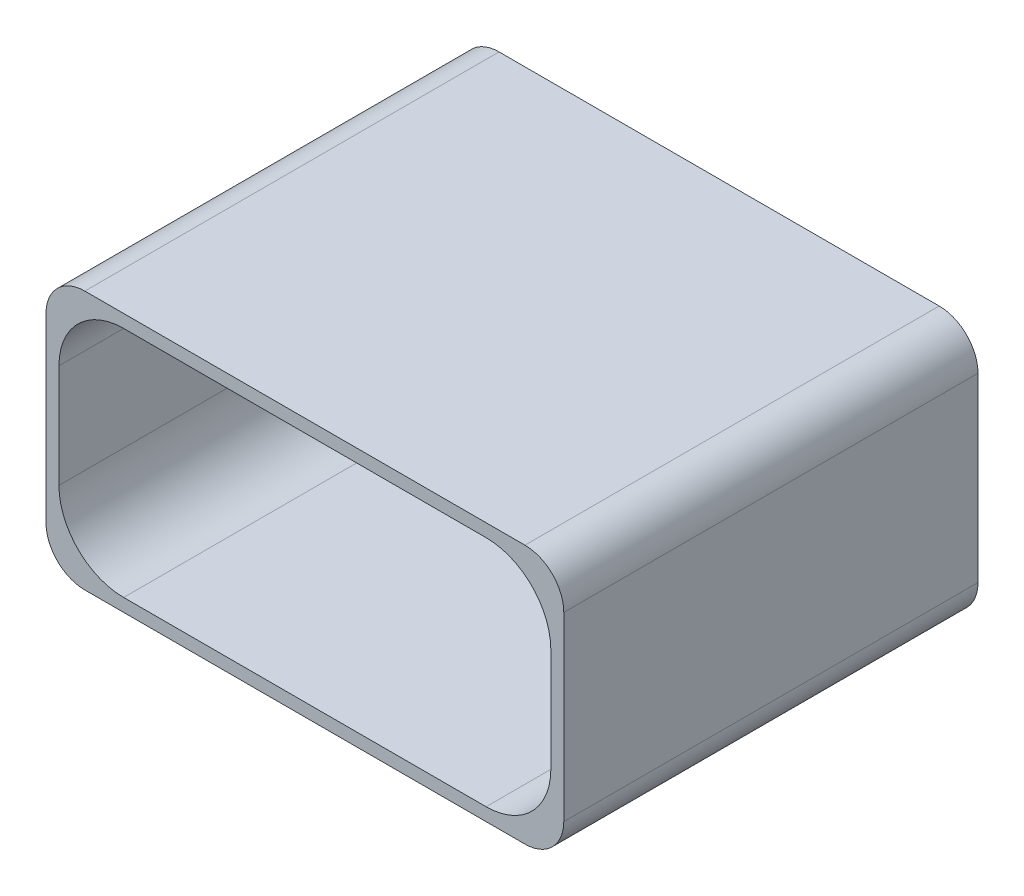
from build123d import *

# Parameters (mm, degrees)
SKETCH1_W           = 200
SKETCH1_H           = 100
BOSS_EXTRUDE1_DEPTH = 10
CUT_EXTRUDE1_DEPTH  = 10
BOSS_EXTRUDE2_START = 150
BOSS_EXTRUDE2_DEPTH = 150
BOSS_EXTRUDE3_DEPTH = 80


with BuildPart() as part:
    # Sketch1 → Boss-Extrude1 (new body)
    with BuildSketch(Plane.XY):
        with Locations((100, 50)):
            Rectangle(SKETCH1_W, SKETCH1_H)
    extrude(amount=BOSS_EXTRUDE1_DEPTH)

    # Sketch2 → Cut-Extrude1 (cut)
    with BuildSketch(Plane.XY.offset(10)):
        with BuildLine():
            ThreePointArc((0, 85), (4.393398282, 95.606601718), (15, 100))
            Line((15, 100), (0, 100))
            Line((0, 100), (0, 85))
        make_face()
        with BuildLine():
            Line((200, 100), (185, 100))
            ThreePointArc((185, 100), (195.606601718, 95.606601718), (200, 85))
            Line((200, 85), (200, 100))
        make_face()
        with BuildLine():
            Line((200, 0), (200, 15))
            ThreePointArc((200, 15), (195.606601718, 4.393398282), (185, 0))
            Line((185, 0), (200, 0))
        make_face()
        with BuildLine():
            ThreePointArc((15, 0), (4.393398282, 4.393398282), (0, 15))
            Line((0, 15), (0, 0))
            Line((0, 0), (15, 0))
        make_face()
    extrude(amount=-CUT_EXTRUDE1_DEPTH, mode=Mode.SUBTRACT)

    # Sketch3 → Boss-Extrude2 (add)
    with BuildSketch(Plane.XY.offset(10).offset(BOSS_EXTRUDE2_START)):
        with BuildLine():
            Line((100, 100), (185, 100))
            ThreePointArc((185, 100), (195.606601718, 95.606601718), (200, 85))
            Line((200, 85), (200, 15))
            ThreePointArc((200, 15), (195.606601718, 4.393398282), (185, 0))
            Line((185, 0), (15, 0))
            ThreePointArc((15, 0), (4.393398282, 4.393398282), (0, 15))
            Line((0, 15), (0, 85))
            ThreePointArc((0, 85), (4.393398282, 95.606601718), (15, 100))
            Line((15, 100), (100, 100))
        make_face()
        with BuildLine():
            Line((30, 95), (170, 95))
            ThreePointArc((170, 95), (187.67766953, 87.67766953), (195, 70))
            Line((195, 70), (195, 30))
            ThreePointArc((195, 30), (187.67766953, 12.32233047), (170, 5))
            Line((170, 5), (30, 5))
            ThreePointArc((30, 5), (12.32233047, 12.32233047), (5, 30))
            Line((5, 30), (5, 70))
            ThreePointArc((5, 70), (12.32233047, 87.67766953), (30, 95))
        make_face(mode=Mode.SUBTRACT)
    extrude(amount=-BOSS_EXTRUDE2_DEPTH)

    # Sketch4 → Boss-Extrude3 (add)
    with BuildSketch(Plane.XY.offset(10)):
        Polygon((66, 60.5), (56, 60.5), (56, 39.5), (66, 39.5), (66, 49.5), (65, 49.5), (65, 50), (65, 50.5), (66, 50.5), align=None)
        Polygon((144, 39.5), (134, 39.5), (134, 49.5), (135, 49.5), (135, 50), (135, 50.5), (134, 50.5), (134, 60.5), (144, 60.5), align=None)
    extrude(amount=BOSS_EXTRUDE3_DEPTH)


solid = part.part
